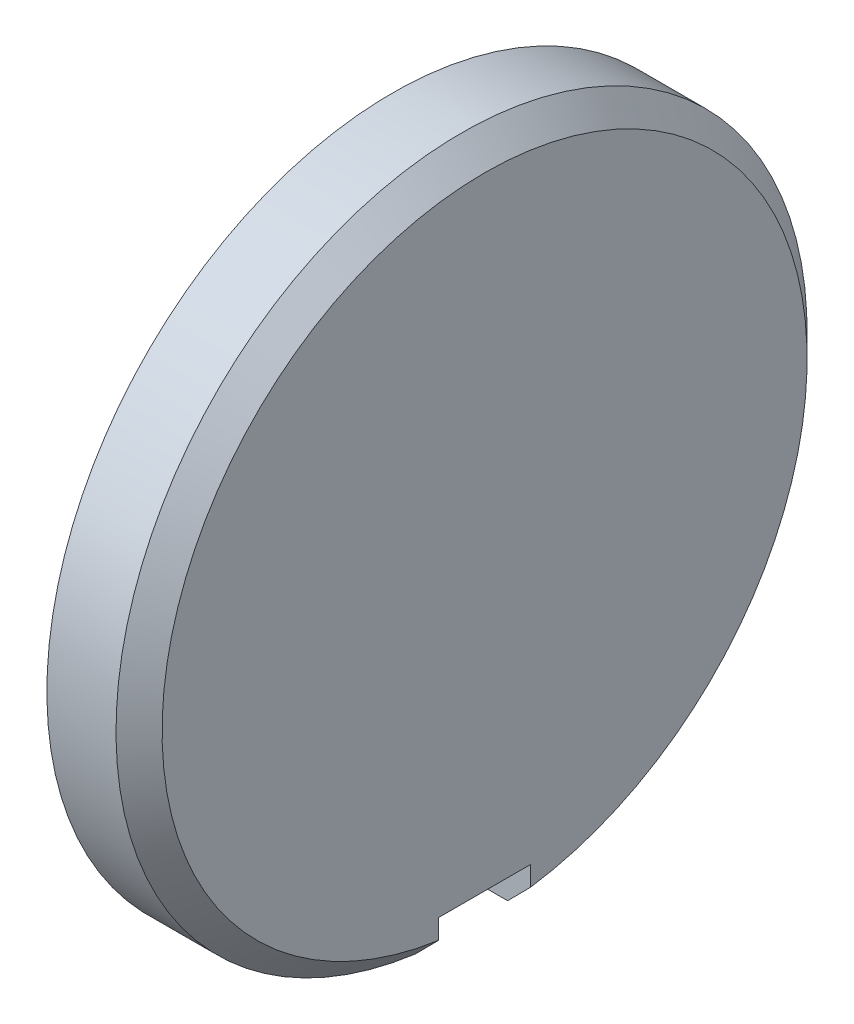
from build123d import *

# Parameters (mm, degrees)
BOSS_EXTRUDE1_START = 62.8
SKETCH2_W           = 1.28
SKETCH2_H           = 0.8
BOSS_EXTRUDE1_DEPTH = 6.4
BOSS_EXTRUDE2_START = 65.6
SKETCH3_W           = 1.28
SKETCH3_H           = 6.4
BOSS_EXTRUDE2_DEPTH = 0.8
BOSS_EXTRUDE3_START = 65.2
SKETCH4_W           = 1.8
SKETCH4_H           = 0.9
BOSS_EXTRUDE3_DEPTH = 1.6


with BuildPart() as part:
    # Sketch1 → Revolve1 (revolve)
    with BuildSketch(Plane.XY.offset(66), mode=Mode.PRIVATE) as revolve1_sk:
        Polygon((58.2, 20.3), (59.4, 20.3), (59.4, 18), (61, 18), (61, 23.6), (60.6, 24), (59.4, 24), (59.4, 21), (58.2, 21), align=None)
    revolve(revolve1_sk.sketch.rotate(Axis((53.2, 18, 66), (1, 0, 0)), 90), axis=Axis((53.2, 18, 66), (1, 0, 0)))


with BuildPart() as body_2:
    # Sketch2 → Boss-Extrude1 (new body)
    with BuildSketch(Plane.XY.offset(BOSS_EXTRUDE1_START)):
        with Locations((58.74, 18)):
            Rectangle(SKETCH2_W, SKETCH2_H)
    extrude(amount=BOSS_EXTRUDE1_DEPTH)


with BuildPart() as part_1:
    add(part.part)

    # Combine1: cut body 2
    add(body_2.part, mode=Mode.SUBTRACT)


with BuildPart() as body_2_2:
    # Sketch3 → Boss-Extrude2 (new body)
    with BuildSketch(Plane.XY.offset(BOSS_EXTRUDE2_START)):
        with Locations((58.74, 18)):
            Rectangle(SKETCH3_W, SKETCH3_H)
    extrude(amount=BOSS_EXTRUDE2_DEPTH)


with BuildPart() as part_2:
    add(part_1.part)

    # Combine2: cut body 2 2
    add(body_2_2.part, mode=Mode.SUBTRACT)


with BuildPart() as body_2_3:
    # Sketch4 → Boss-Extrude3 (new body)
    with BuildSketch(Plane.XY.offset(BOSS_EXTRUDE3_START)):
        with Locations((60.2, 12.35)):
            Rectangle(SKETCH4_W, SKETCH4_H)
    extrude(amount=BOSS_EXTRUDE3_DEPTH)


with BuildPart() as part_3:
    add(part_2.part)

    # Combine3: cut body 2 3
    add(body_2_3.part, mode=Mode.SUBTRACT)


solid = part_3.part
